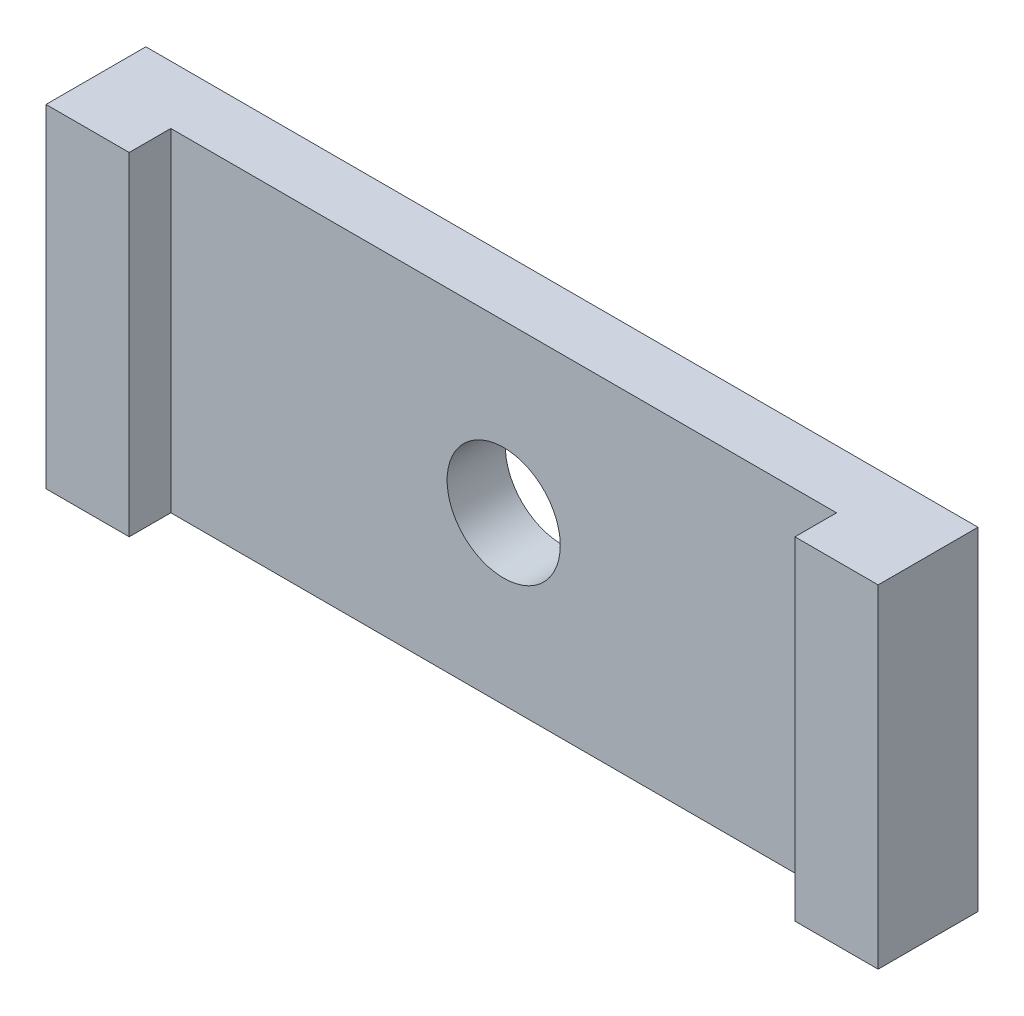
from build123d import *

# Parameters (mm, degrees)
DODANIE_WYCI_GNI_CIE1_DEPTH = 20
OTW_R_GWINTOWANY_M81_D      = 6.8


with BuildPart() as part:
    # Szkic1 → Dodanie-wyciągnięcie1 (new body)
    with BuildSketch(Plane(origin=(0, 0, 0), x_dir=(1, 0, 0), z_dir=(0, 1, 0))):
        Polygon((0, -2.5), (0, 0), (40, 0), (40, -2.5), (45, -2.5), (45, 3.5), (-5, 3.5), (-5, -2.5), align=None)
    extrude(amount=DODANIE_WYCI_GNI_CIE1_DEPTH)

    # Otwór gwintowany M81 (through all)
    with Locations(Plane(origin=(20, 10, 0), x_dir=(1, 0, 0), z_dir=(0, 0, 1))):
        with Locations((0, 0)):
            Hole(OTW_R_GWINTOWANY_M81_D / 2)


solid = part.part
